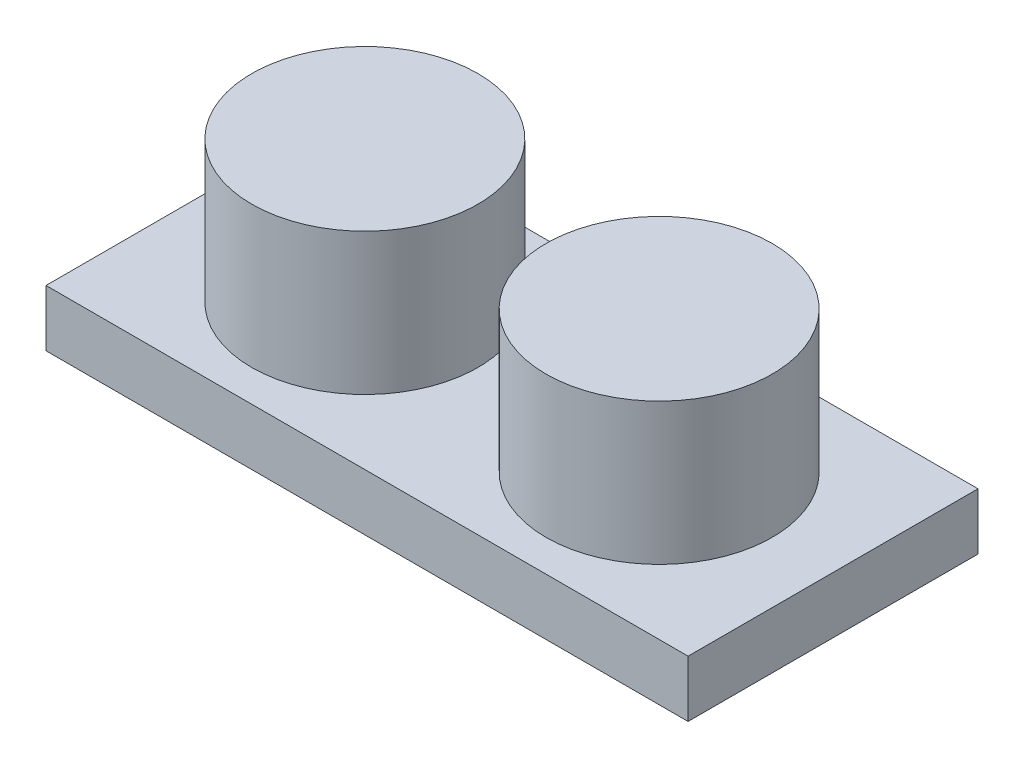
from build123d import *

# Parameters (mm, degrees)
SKETCH_1_W      = 45.4
SKETCH_1_H      = 20.5
EXTRUDE_3_DEPTH = 4
SKETCH_1_5_R    = 8
EXTRUDE_4_DEPTH = 14


with BuildPart() as part:
    # 草圖1 → 填料-伸長3 (new body)
    with BuildSketch(Plane(origin=(0, 0, 0), x_dir=(1, 0, 0), z_dir=(0, 1, 0))):
        Rectangle(SKETCH_1_W, SKETCH_1_H)
    extrude(amount=EXTRUDE_3_DEPTH)

    # 草圖1<5> → 填料-伸長4 (add)
    with BuildSketch(Plane(origin=(0, 0, 0), x_dir=(1, 0, 0), z_dir=(0, 1, 0))):
        with Locations((-10.404166667, 0)):
            Circle(SKETCH_1_5_R)
        with Locations((10.404166667, 0)):
            Circle(SKETCH_1_5_R)
    extrude(amount=EXTRUDE_4_DEPTH)


solid = part.part
